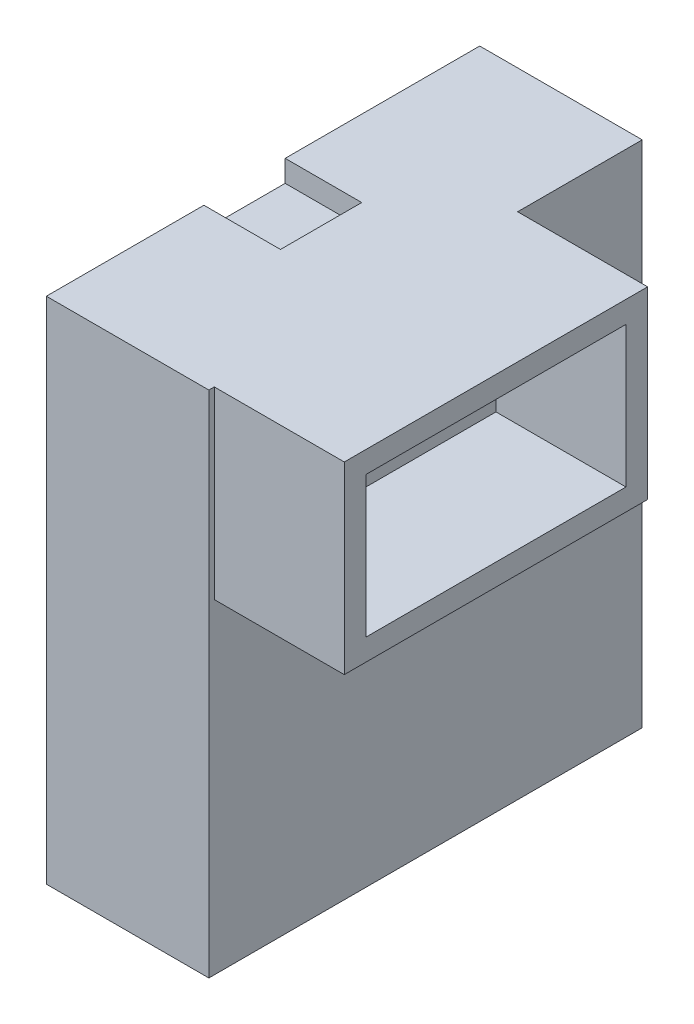
from build123d import *

# Parameters (mm, degrees)
SKETCH1_W           = 40
SKETCH1_H           = 47
BOSS_EXTRUDE1_DEPTH = 15
SKETCH2_W           = 28
SKETCH2_H           = 17
SKETCH2_W_2         = 24
SKETCH2_H_2         = 13
BOSS_EXTRUDE2_DEPTH = 12
SKETCH4_W           = 7.067405003
SKETCH4_H           = 7.5
CUT_EXTRUDE1_DEPTH  = 2


with BuildPart() as part:
    # Sketch1 → Boss-Extrude1 (new body)
    with BuildSketch(Plane(origin=(0, 0, 0), x_dir=(0, 0, -1), z_dir=(1, 0, 0))):
        Rectangle(SKETCH1_W, SKETCH1_H)
    extrude(amount=BOSS_EXTRUDE1_DEPTH)

    # Sketch2 → Boss-Extrude2 (add)
    with BuildSketch(Plane(origin=(15, 0, 0), x_dir=(0, 0, -1), z_dir=(1, 0, 0))):
        with Locations((-5.5, 15)):
            Rectangle(SKETCH2_W, SKETCH2_H)
        with Locations((-5.5, 15)):
            Rectangle(SKETCH2_W_2, SKETCH2_H_2, mode=Mode.SUBTRACT)
    extrude(amount=BOSS_EXTRUDE2_DEPTH)

    # Sketch4 → Cut-Extrude1 (cut)
    with BuildSketch(Plane(origin=(0, 23.5, 0), x_dir=(1, 0, 0), z_dir=(0, 1, 0))):
        with Locations((3.533702502, -1.707739217)):
            Rectangle(SKETCH4_W, SKETCH4_H)
    extrude(amount=-CUT_EXTRUDE1_DEPTH, mode=Mode.SUBTRACT)


solid = part.part
